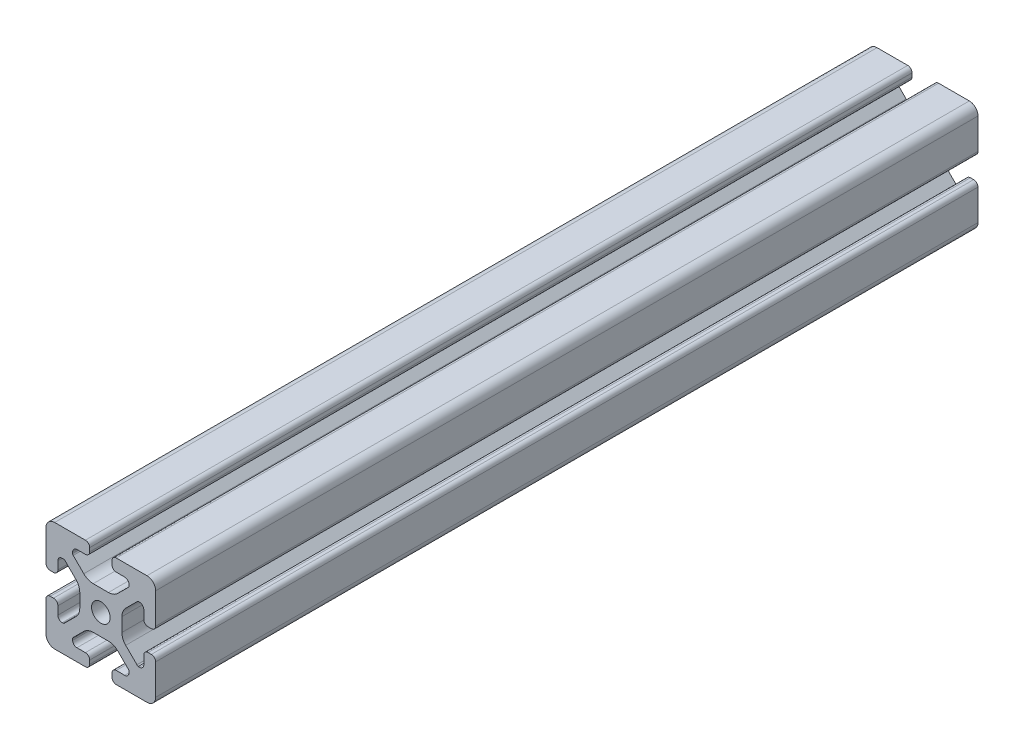
from build123d import *

# Parameters (mm, degrees)
SKETCH1_R      = 3.4
EXTRUDE1_DEPTH = 300


with BuildPart() as part:
    # Sketch1 → Extrude1 (new body)
    with BuildSketch(Plane.XY):
        with BuildLine():
            Line((-8.715, -15.524615034), (-5.63, -15.524615034))
            ThreePointArc((-5.63, -15.524615034), (-4.519842354, -15.984457388), (-4.06, -17.094615034))
            Line((-4.06, -17.094615034), (-4.06, -18.43))
            ThreePointArc((-4.06, -18.43), (-4.519842354, -19.540157646), (-5.63, -20))
            Line((-5.63, -20), (-16.674615034, -20))
            ThreePointArc((-16.674615034, -20), (-18.951578385, -19.194274381), (-20, -17.018368134))
            Line((-20, -17.018368134), (-20, -5.757918808))
            ThreePointArc((-20, -5.757918808), (-19.564709668, -4.603883664), (-18.43, -4.120449326))
            Line((-18.43, -4.120449326), (-17.25, -4.120449326))
            ThreePointArc((-17.25, -4.120449326), (-16.115287682, -4.60388249), (-15.67999625, -5.757919334))
            Line((-15.67999625, -5.757919334), (-15.67999625, -8.715399492))
            ThreePointArc((-15.67999625, -8.715399492), (-15.220153896, -9.825557139), (-14.10999625, -10.285399492))
            Line((-14.10999625, -10.285399492), (-13.816898819, -10.285399492))
            ThreePointArc((-13.816898819, -10.285399492), (-13.526061711, -10.227547119), (-13.279501941, -10.062800646))
            Line((-13.279501941, -10.062800646), (-9.076242789, -5.859541495))
            ThreePointArc((-9.076242789, -5.859541495), (-8.046572221, -4.318530588), (-7.685, -2.500784284))
            Line((-7.685, -2.500784284), (-7.685, 2.500784284))
            ThreePointArc((-7.685, 2.500784284), (-8.046572221, 4.318530588), (-9.076242789, 5.859541495))
            Line((-9.076242789, 5.859541495), (-13.040489136, 9.823787841))
            ThreePointArc((-13.040489136, 9.823787841), (-13.354224618, 10.012729352), (-13.71989919, 10.033001362))
            Line((-13.71989919, 10.033001362), (-14.05520779, 10.044710596))
            ThreePointArc((-14.05520779, 10.044710596), (-15.200613642, 9.605030484), (-15.68, 8.475666998))
            Line((-15.68, 8.475666998), (-15.68, 5.572979049))
            ThreePointArc((-15.68, 5.572979049), (-16.139842354, 4.462821403), (-17.25, 4.002979049))
            Line((-17.25, 4.002979049), (-18.43, 4.002979049))
            ThreePointArc((-18.43, 4.002979049), (-19.540157646, 4.462821403), (-20, 5.572979049))
            Line((-20, 5.572979049), (-20, 13.004526564))
            Line((-20, 13.004526564), (-20, 16.83))
            ThreePointArc((-20, 16.83), (-19.071528496, 19.071528496), (-16.83, 20))
            Line((-16.83, 20), (-5.63, 20))
            ThreePointArc((-5.63, 20), (-4.519842354, 19.540157646), (-4.06, 18.43))
            Line((-4.06, 18.43), (-4.06, 17.094615034))
            ThreePointArc((-4.06, 17.094615034), (-4.519842354, 15.984457388), (-5.63, 15.524615034))
            Line((-5.63, 15.524615034), (-8.715, 15.524615034))
            ThreePointArc((-8.715, 15.524615034), (-9.825157646, 15.06477268), (-10.285, 13.954615034))
            Line((-10.285, 13.954615034), (-10.285, 13.492503602))
            ThreePointArc((-10.285, 13.492503602), (-10.227148445, 13.201664194), (-10.062401154, 12.955102448))
            Line((-10.062401154, 12.955102448), (-6.217092793, 9.109794088))
            ThreePointArc((-6.217092793, 9.109794088), (-4.63891877, 8.055291919), (-2.777335583, 7.685))
            Line((-2.777335583, 7.685), (2.777335583, 7.685))
            ThreePointArc((2.777335583, 7.685), (4.63891877, 8.055291919), (6.217092793, 9.109794088))
            Line((6.217092793, 9.109794088), (10.062401154, 12.955102448))
            ThreePointArc((10.062401154, 12.955102448), (10.227148445, 13.201664194), (10.285, 13.492503602))
            Line((10.285, 13.492503602), (10.285, 13.954615034))
            ThreePointArc((10.285, 13.954615034), (9.825157646, 15.06477268), (8.715, 15.524615034))
            Line((8.715, 15.524615034), (5.63, 15.524615034))
            ThreePointArc((5.63, 15.524615034), (4.519842354, 15.984457388), (4.06, 17.094615034))
            Line((4.06, 17.094615034), (4.06, 18.43))
            ThreePointArc((4.06, 18.43), (4.519842354, 19.540157646), (5.63, 20))
            Line((5.63, 20), (12.979635074, 20))
            Line((12.979635074, 20), (16.83, 20))
            ThreePointArc((16.83, 20), (19.071528496, 19.071528496), (20, 16.83))
            Line((20, 16.83), (20, 13.001098436))
            Line((20, 13.001098436), (20, 5.63))
            ThreePointArc((20, 5.63), (19.540157461, 4.519842693), (18.43, 4.060000526))
            Line((18.43, 4.060000526), (17.24999625, 4.060000526))
            ThreePointArc((17.24999625, 4.060000526), (16.139838603, 4.519842879), (15.67999625, 5.630000526))
            Line((15.67999625, 5.630000526), (15.67999625, 8.715399492))
            ThreePointArc((15.67999625, 8.715399492), (15.220153896, 9.825557139), (14.10999625, 10.285399492))
            Line((14.10999625, 10.285399492), (13.816903094, 10.285399492))
            ThreePointArc((13.816903094, 10.285399492), (13.526063686, 10.227547937), (13.279501941, 10.062800646))
            Line((13.279501941, 10.062800646), (9.076242789, 5.859541495))
            ThreePointArc((9.076242789, 5.859541495), (8.046572221, 4.318530588), (7.685, 2.500784284))
            Line((7.685, 2.500784284), (7.685, -2.500784284))
            ThreePointArc((7.685, -2.500784284), (8.046572221, -4.318530588), (9.076242789, -5.859541495))
            Line((9.076242789, -5.859541495), (13.163657296, -9.946956002))
            ThreePointArc((13.163657296, -9.946956002), (13.35903797, -10.160433474), (13.6200547, -10.285399492))
            Line((13.6200547, -10.285399492), (14.10999625, -10.285399492))
            ThreePointArc((14.10999625, -10.285399492), (15.220153896, -9.825557139), (15.67999625, -8.715399492))
            Line((15.67999625, -8.715399492), (15.67999625, -5.630000526))
            ThreePointArc((15.67999625, -5.630000526), (16.139838603, -4.519842879), (17.24999625, -4.060000526))
            Line((17.24999625, -4.060000526), (18.43, -4.060000526))
            ThreePointArc((18.43, -4.060000526), (19.540157461, -4.519842693), (20, -5.63))
            Line((20, -5.63), (20, -16.83))
            ThreePointArc((20, -16.83), (19.071528496, -19.071528496), (16.83, -20))
            Line((16.83, -20), (13, -20))
            Line((13, -20), (5.63, -20))
            ThreePointArc((5.63, -20), (4.519842354, -19.540157646), (4.06, -18.43))
            Line((4.06, -18.43), (4.06, -17.094615034))
            ThreePointArc((4.06, -17.094615034), (4.519842354, -15.984457388), (5.63, -15.524615034))
            Line((5.63, -15.524615034), (8.715, -15.524615034))
            ThreePointArc((8.715, -15.524615034), (9.825157646, -15.06477268), (10.285, -13.954615034))
            Line((10.285, -13.954615034), (10.285, -13.492503602))
            ThreePointArc((10.285, -13.492503602), (10.227148445, -13.201664194), (10.062401154, -12.955102448))
            Line((10.062401154, -12.955102448), (6.217092793, -9.109794088))
            ThreePointArc((6.217092793, -9.109794088), (4.63891877, -8.055291919), (2.777335583, -7.685))
            Line((2.777335583, -7.685), (-2.777335583, -7.685))
            ThreePointArc((-2.777335583, -7.685), (-4.63891877, -8.055291919), (-6.217092793, -9.109794088))
            Line((-6.217092793, -9.109794088), (-10.062401154, -12.955102448))
            ThreePointArc((-10.062401154, -12.955102448), (-10.227148445, -13.201664194), (-10.285, -13.492503602))
            Line((-10.285, -13.492503602), (-10.285, -13.954615034))
            ThreePointArc((-10.285, -13.954615034), (-9.825157646, -15.06477268), (-8.715, -15.524615034))
        make_face()
        Circle(SKETCH1_R, mode=Mode.SUBTRACT)
    extrude(amount=-EXTRUDE1_DEPTH)


solid = part.part
